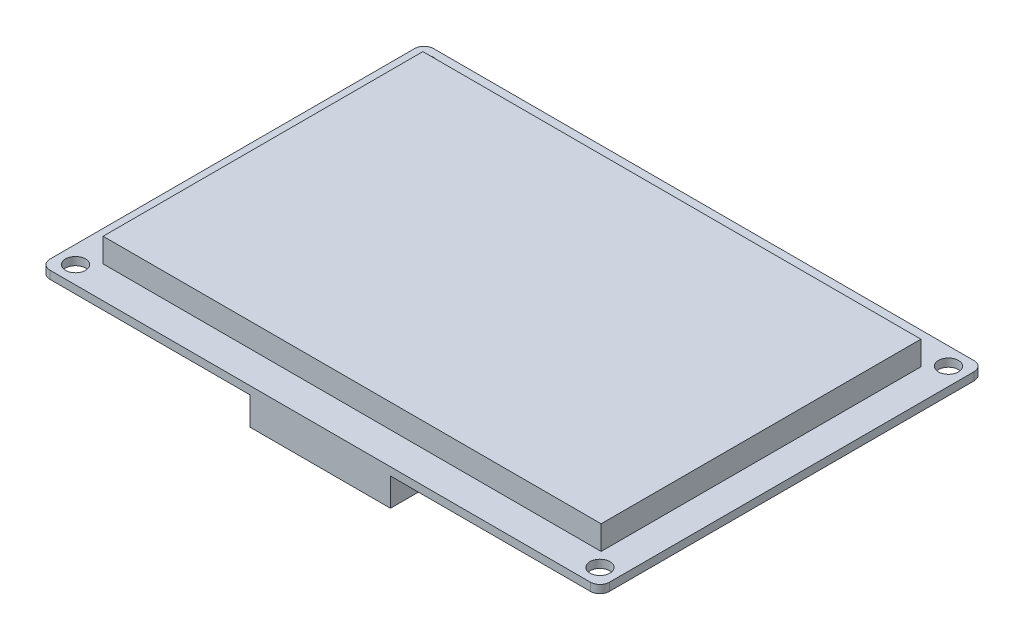
from build123d import *

# Parameters (mm, degrees)
SKETCH1_W           = 70
SKETCH1_H           = 48
SKETCH1_R           = 1.25
BOSS_EXTRUDE1_DEPTH = 1
SKETCH2_W           = 62.3
SKETCH2_H           = 40
BOSS_EXTRUDE2_DEPTH = 3
SKETCH4_W           = 17.6
SKETCH4_H           = 31
BOSS_EXTRUDE3_DEPTH = 3.5
FILLET1_R           = 1.2


with BuildPart() as part:
    # Sketch1 → Boss-Extrude1 (new body)
    with BuildSketch(Plane(origin=(0, 0, 0), x_dir=(1, 0, 0), z_dir=(0, 1, 0))):
        Rectangle(SKETCH1_W, SKETCH1_H)
        with Locations(Location((-32.8, 21.8, 0), (0, 0, 270))):
            Circle(SKETCH1_R, mode=Mode.SUBTRACT)
        with Locations(Location((-32.8, -21.8, 0), (0, 0, 90))):
            Circle(SKETCH1_R, mode=Mode.SUBTRACT)
        with Locations(Location((32.8, -21.8, 0), (0, 0, 270))):
            Circle(SKETCH1_R, mode=Mode.SUBTRACT)
        with Locations(Location((32.8, 21.8, 0), (0, 0, 90))):
            Circle(SKETCH1_R, mode=Mode.SUBTRACT)
    extrude(amount=BOSS_EXTRUDE1_DEPTH)

    # Sketch2 → Boss-Extrude2 (add)
    with BuildSketch(Plane(origin=(0, 1, 0), x_dir=(1, 0, 0), z_dir=(0, 1, 0))):
        Rectangle(SKETCH2_W, SKETCH2_H)
    extrude(amount=BOSS_EXTRUDE2_DEPTH)

    # Sketch4 → Boss-Extrude3 (add)
    with BuildSketch(Plane.XZ):
        with Locations((0, 8.5)):
            Rectangle(SKETCH4_W, SKETCH4_H)
    extrude(amount=BOSS_EXTRUDE3_DEPTH)

    # Fillet1
    fillet1_edges = [part.edges().sort_by_distance(p)[0] for p in [
        (35, 0.5, 24),
        (-35, 0.5, 24),
        (-35, 0.5, -24),
        (35, 0.5, -24),
    ]]
    fillet(fillet1_edges, radius=FILLET1_R)


solid = part.part
